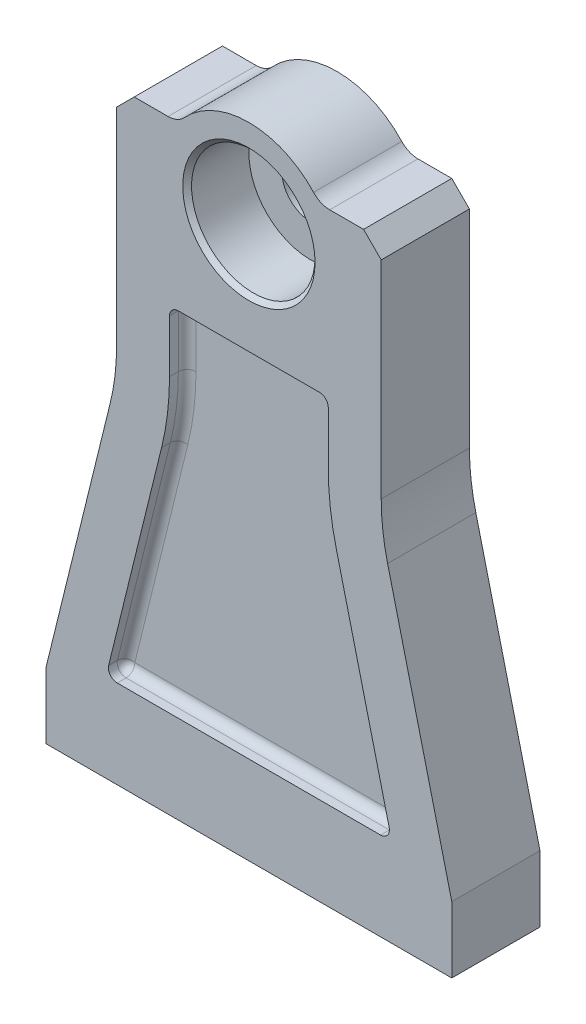
from build123d import *

# Parameters (mm, degrees)
BOSS_EXTRUDE1_DEPTH               = 10
FILLET1_R                         = 50
FILLET2_R                         = 50
CUT_EXTRUDE1_DEPTH                = 4
SKETCH6_R                         = 6.5
CUT_EXTRUDE2_DEPTH                = 89.160365244
SKETCH7_R                         = 14
CUT_EXTRUDE3_DEPTH                = 14
CHAMFER1_SIZE                     = 4
FILLET3_R                         = 5
TAP_DRILL_FOR_M10X1_25_TAP1_D     = 8.8
TAP_DRILL_FOR_M10X1_25_TAP1_DEPTH = 20
TAP_DRILL_FOR_M10X1_25_TAP1_TIP   = 4.4
CHAMFER2_SIZE                     = 1
FILLET4_R                         = 2


with BuildPart() as part:
    # Sketch2 → Boss-Extrude1 (new, symmetric)
    with BuildSketch(Plane.XY):
        with BuildLine():
            Line((16, 64.5), (30, 64.5))
            Line((30, 64.5), (30, 7.5))
            Line((30, 7.5), (46, -57.5))
            Line((46, -57.5), (46, -72.5))
            Line((46, -72.5), (-46, -72.5))
            Line((-46, -72.5), (-46, -57.5))
            Line((-46, -57.5), (-30, 7.5))
            Line((-30, 7.5), (-30, 64.5))
            Line((-30, 64.5), (-16, 64.5))
            ThreePointArc((-16, 64.5), (0, 72.5), (16, 64.5))
        make_face()
    extrude(amount=BOSS_EXTRUDE1_DEPTH, both=True)

    # Fillet1
    fillet1_edges = [part.edges().sort_by_distance(p)[0] for p in [
        (-30, 7.5, 0),
    ]]
    fillet(fillet1_edges, radius=FILLET1_R)

    # Fillet2
    fillet2_edges = [part.edges().sort_by_distance(p)[0] for p in [
        (30, 7.5, 0),
    ]]
    fillet(fillet2_edges, radius=FILLET2_R)

    # Sketch5 → Cut-Extrude1 (cut)
    with BuildSketch(Plane.XY.offset(10)):
        with BuildLine():
            Line((-19.797077506, -1.255831282), (-31.801048121, -50.021961906))
            ThreePointArc((-31.801048121, -50.021961906), (-31.433196909, -51.733678202), (-29.859018363, -52.5))
            Line((-29.859018363, -52.5), (29.859018363, -52.5))
            ThreePointArc((29.859018363, -52.5), (31.433196909, -51.733678202), (31.801048121, -50.021961906))
            Line((31.801048121, -50.021961906), (19.797077506, -1.255831282))
            ThreePointArc((19.797077506, -1.255831282), (18.450909046, 6.09947647), (18, 13.56334964))
            Line((18, 13.56334964), (18, 25.5))
            ThreePointArc((18, 25.5), (17.414213562, 26.914213562), (16, 27.5))
            Line((16, 27.5), (-16, 27.5))
            ThreePointArc((-16, 27.5), (-17.414213562, 26.914213562), (-18, 25.5))
            Line((-18, 25.5), (-18, 13.56334964))
            ThreePointArc((-18, 13.56334964), (-18.450909046, 6.09947647), (-19.797077506, -1.255831282))
        make_face()
    cut_extrude1 = extrude(amount=-CUT_EXTRUDE1_DEPTH, mode=Mode.SUBTRACT)

    # Mirror1: Cut-Extrude1 across plane
    add(cut_extrude1.mirror(Plane.XY), mode=Mode.SUBTRACT)

    # Sketch6 → Cut-Extrude2 (cut, through all)
    with BuildSketch(Plane.XY.offset(10)):
        with Locations((0, 52.5)):
            Circle(SKETCH6_R)
    extrude(amount=-CUT_EXTRUDE2_DEPTH, mode=Mode.SUBTRACT)

    # Sketch7 → Cut-Extrude3 (cut)
    with BuildSketch(Plane.XY.offset(10)):
        with Locations((0, 52.5)):
            Circle(SKETCH7_R)
    extrude(amount=-CUT_EXTRUDE3_DEPTH, mode=Mode.SUBTRACT)

    # Chamfer1
    chamfer1_edges = [part.edges().sort_by_distance(p)[0] for p in [
        (-30, 64.5, 0),
        (30, 64.5, 0),
    ]]
    chamfer(chamfer1_edges, length=CHAMFER1_SIZE)

    # Fillet3
    fillet3_edges = [part.edges().sort_by_distance(p)[0] for p in [
        (-16, 64.5, 0),
        (16, 64.5, 0),
    ]]
    fillet(fillet3_edges, radius=FILLET3_R)

    # Tap Drill for M10x1.25 Tap1
    with Locations(Plane(origin=(0, -72.5, 0), x_dir=(-1, 0, 0), z_dir=(0, -1, 0))):
        with Locations((30, 0), (-30, 0)):
            Hole(TAP_DRILL_FOR_M10X1_25_TAP1_D / 2, depth=TAP_DRILL_FOR_M10X1_25_TAP1_DEPTH)
            with Locations((0, 0, -(TAP_DRILL_FOR_M10X1_25_TAP1_DEPTH + TAP_DRILL_FOR_M10X1_25_TAP1_TIP / 2))):  # 90° drill point
                Cone(0, TAP_DRILL_FOR_M10X1_25_TAP1_D / 2, TAP_DRILL_FOR_M10X1_25_TAP1_TIP, mode=Mode.SUBTRACT)

    # Chamfer2
    chamfer2_edges = [part.edges().sort_by_distance(p)[0] for p in [
        (-14, 52.5, 10),
    ]]
    chamfer(chamfer2_edges, length=CHAMFER2_SIZE)

    # Fillet4
    fillet4_edges = [part.edges().sort_by_distance(p)[0] for p in [
        (31.433196909, -51.733678202, 6),
        (0, -52.5, 6),
        (-31.433196909, -51.733678202, 6),
        (-25.799062814, -25.638896594, 6),
        (-18.450909046, 6.09947647, 6),
        (-18, 19.53167482, 6),
        (-17.414213562, 26.914213562, 6),
        (0, 27.5, 6),
        (17.414213562, 26.914213562, 6),
        (18, 19.53167482, 6),
        (18.450909046, 6.09947647, 6),
        (25.799062814, -25.638896594, 6),
        (31.433196909, -51.733678202, -6),
        (25.799062814, -25.638896594, -6),
        (18.450909046, 6.09947647, -6),
        (18, 19.53167482, -6),
        (17.414213562, 26.914213562, -6),
        (0, 27.5, -6),
        (-17.414213562, 26.914213562, -6),
        (-18, 19.53167482, -6),
        (-18.450909046, 6.09947647, -6),
        (-25.799062814, -25.638896594, -6),
        (-31.433196909, -51.733678202, -6),
        (0, -52.5, -6),
    ]]
    fillet(fillet4_edges, radius=FILLET4_R)


solid = part.part
